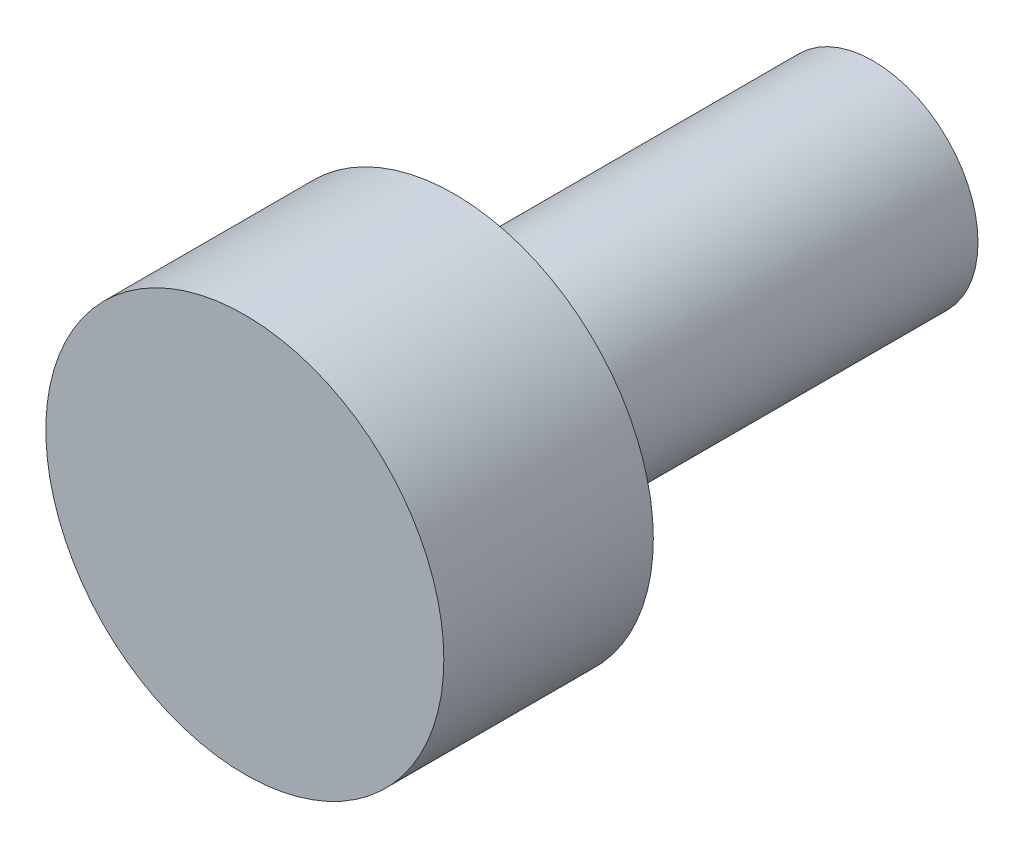
from build123d import *

# Parameters (mm, degrees)
THREAD_ENVELOPE_START = -4
SKETCH1_R             = 1
THREAD_ENVELOPE_DEPTH = 4
SKETCH2_R             = 1.9
HEAD_ENVELOPE_DEPTH   = 2


with BuildPart() as part:
    # Sketch1 → Thread_Envelope (new body)
    with BuildSketch(Plane.XY.offset(THREAD_ENVELOPE_START)):
        Circle(SKETCH1_R)
    extrude(amount=THREAD_ENVELOPE_DEPTH)

    # Sketch2 → Head_Envelope (add)
    with BuildSketch(Plane.XY):
        Circle(SKETCH2_R)
    extrude(amount=HEAD_ENVELOPE_DEPTH)


solid = part.part
